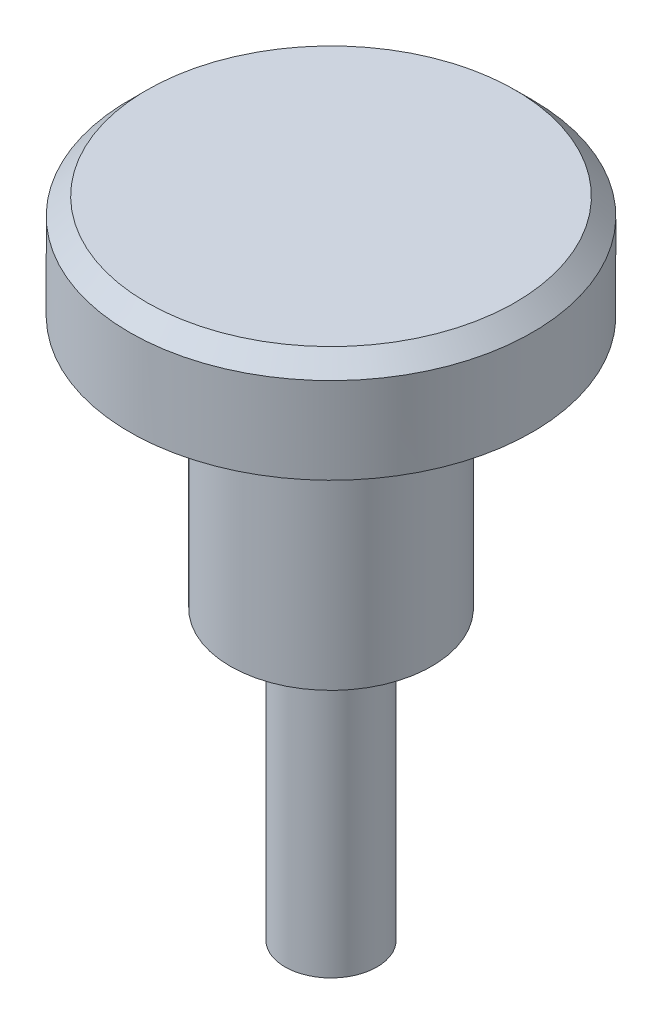
from build123d import *

# Parameters (mm, degrees)
CHAMFER1_SIZE = 3


with BuildPart() as part:
    # Sketch3 → Revolve1 (revolve)
    with BuildSketch(Plane.XY, mode=Mode.PRIVATE) as revolve1_sk:
        Polygon((0, 0), (0, 112), (35, 112), (35, 94), (17.5, 94), (17.5, 50), (8, 50), (8, 0), align=None)
    revolve(revolve1_sk.sketch.rotate(Axis((0, 0, 0), (0, 1, 0)), 90), axis=Axis((0, 0, 0), (0, 1, 0)))

    # Chamfer1
    chamfer1_edges = [part.edges().sort_by_distance(p)[0] for p in [
        (0, 112, 35),
    ]]
    chamfer(chamfer1_edges, length=CHAMFER1_SIZE)


solid = part.part
